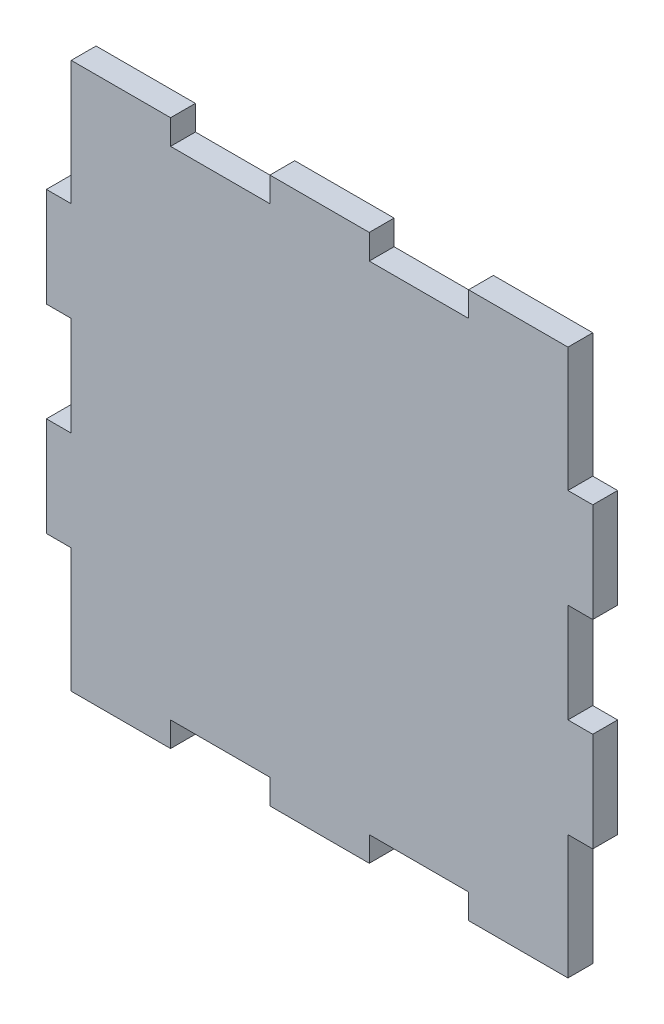
from build123d import *

# Parameters (mm, degrees)
RESSALTO_EXTRUS_O1_DEPTH = 3


with BuildPart() as part:
    # Esboço1 → Ressalto-extrusão1 (new body)
    with BuildSketch(Plane.XY):
        Polygon((-31.216896784, 9.348259862), (-31.216896784, -2.651740138), (-34.216896784, -2.651740138), (-34.216896784, -14.651740138), (-31.216896784, -14.651740138), (-31.216896784, -26.651740138), (-31.216896784, -29.651740138), (-19.216896784, -29.651740138), (-19.216896784, -26.651740138), (-7.216896784, -26.651740138), (-7.216896784, -29.651740138), (4.783103216, -29.651740138), (4.783103216, -26.651740138), (16.783103216, -26.651740138), (16.783103216, -29.651740138), (28.783103216, -29.651740138), (28.783103216, -26.651740138), (28.783103216, -14.651740138), (31.783103216, -14.651740138), (31.783103216, -2.651740138), (28.783103216, -2.651740138), (28.783103216, 9.348259862), (31.783103216, 9.348259862), (31.783103216, 21.348259862), (28.783103216, 21.348259862), (28.783103216, 33.348259862), (28.783103216, 36.348259862), (16.783103216, 36.348259862), (16.783103216, 33.348259862), (4.783103216, 33.348259862), (4.783103216, 36.348259862), (-7.216896784, 36.348259862), (-7.216896784, 33.348259862), (-19.216896784, 33.348259862), (-19.216896784, 36.348259862), (-31.216896784, 36.348259862), (-31.216896784, 33.348259862), (-31.216896784, 21.348259862), (-34.216896784, 21.348259862), (-34.216896784, 9.348259862), align=None)
    extrude(amount=RESSALTO_EXTRUS_O1_DEPTH)


solid = part.part
